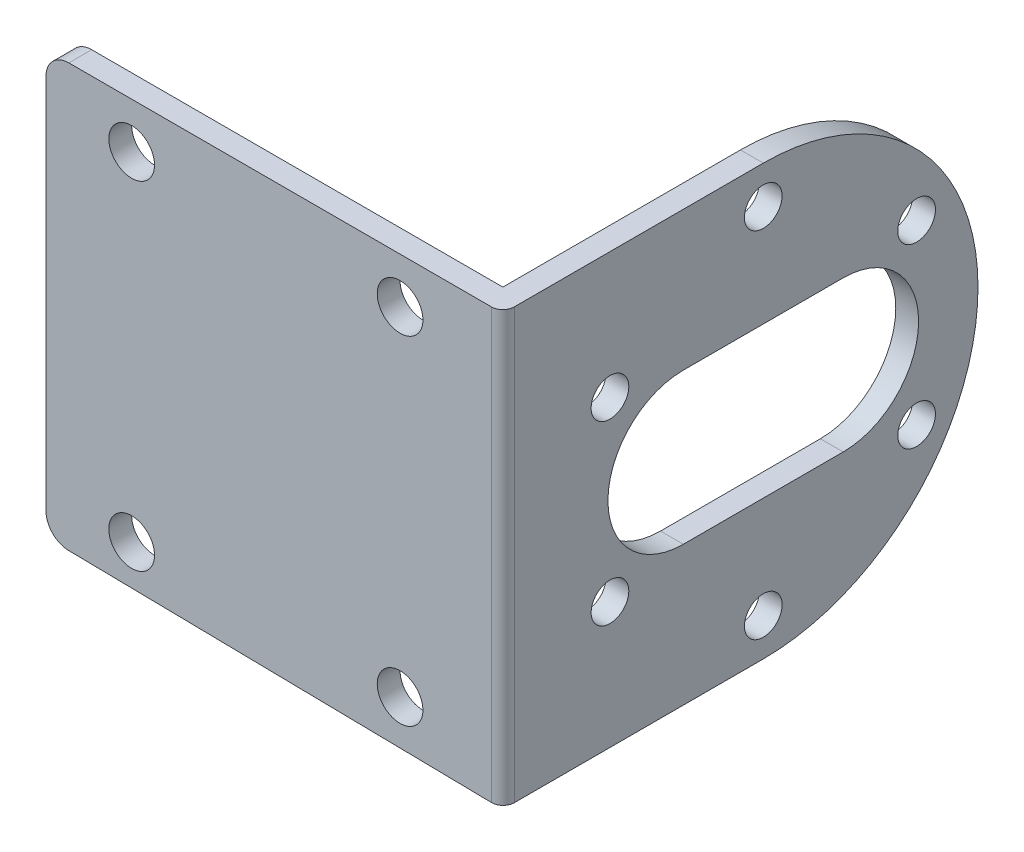
from build123d import *

# Parameters (mm, degrees)
CROQUIS1_R              = 1.65
SALIENTE_EXTRUIR1_DEPTH = 2
SALIENTE_EXTRUIR2_DEPTH = 2
REDONDEO1_R             = 1
REDONDEO2_R             = 2
CROQUIS3_R              = 2
CORTAR_EXTRUIR1_DEPTH   = 60.39696962


with BuildPart() as part:
    # Croquis1 → Saliente-Extruir1 (new body)
    with BuildSketch(Plane(origin=(0, 0, 0), x_dir=(0, 0, -1), z_dir=(1, 0, 0))):
        with BuildLine():
            Line((0, 18.8), (-20.8, 18.8))
            Line((-20.8, 18.8), (-20.8, -18.8))
            Line((-20.8, -18.8), (0, -18.8))
            ThreePointArc((0, -18.8), (18.8, 0), (0, 18.8))
        make_face()
        with Locations((13.423393759, 7.75)):
            Circle(CROQUIS1_R, mode=Mode.SUBTRACT)
        with Locations((13.423393759, -7.75)):
            Circle(CROQUIS1_R, mode=Mode.SUBTRACT)
        with Locations((0, -15.5)):
            Circle(CROQUIS1_R, mode=Mode.SUBTRACT)
        with Locations((-13.423393759, -7.75)):
            Circle(CROQUIS1_R, mode=Mode.SUBTRACT)
        with Locations((-13.423393759, 7.75)):
            Circle(CROQUIS1_R, mode=Mode.SUBTRACT)
        with Locations((0, 15.5)):
            Circle(CROQUIS1_R, mode=Mode.SUBTRACT)
        with BuildLine():
            Line((-7, 6.6), (7, 6.6))
            ThreePointArc((7, 6.6), (13.6, 0), (7, -6.6))
            Line((7, -6.6), (-7, -6.6))
            ThreePointArc((-7, -6.6), (-13.6, 0), (-7, 6.6))
        make_face(mode=Mode.SUBTRACT)
    extrude(amount=SALIENTE_EXTRUIR1_DEPTH)

    # Croquis2 → Saliente-Extruir2 (add)
    with BuildSketch(Plane.XY.offset(20.8)):
        Polygon((2, 18.8), (-38, 18.8), (-38, -18.150603338), (2, -18.8), align=None)
    extrude(amount=SALIENTE_EXTRUIR2_DEPTH)

    # Redondeo1
    redondeo1_edges = [part.edges().sort_by_distance(p)[0] for p in [
        (2, 0, 22.8),
    ]]
    fillet(redondeo1_edges, radius=REDONDEO1_R)

    # Redondeo2
    redondeo2_edges = [part.edges().sort_by_distance(p)[0] for p in [
        (-38, 18.8, 21.8),
        (-38, -18.150603338, 21.8),
    ]]
    fillet(redondeo2_edges, radius=REDONDEO2_R)

    # Croquis3 → Cortar-Extruir1 (cut, through all)
    with BuildSketch(Plane.XY.offset(22.8)):
        with Locations((-7, 14.8)):
            Circle(CROQUIS3_R)
        with Locations(Location((-7, -14.783765083, 0), (0, 0, 180))):
            Circle(CROQUIS3_R)
        with Locations((-30.5, 14.8)):
            Circle(CROQUIS3_R)
        with Locations((-30.5, -14.783765083)):
            Circle(CROQUIS3_R)
    extrude(amount=-CORTAR_EXTRUIR1_DEPTH, mode=Mode.SUBTRACT)


solid = part.part
